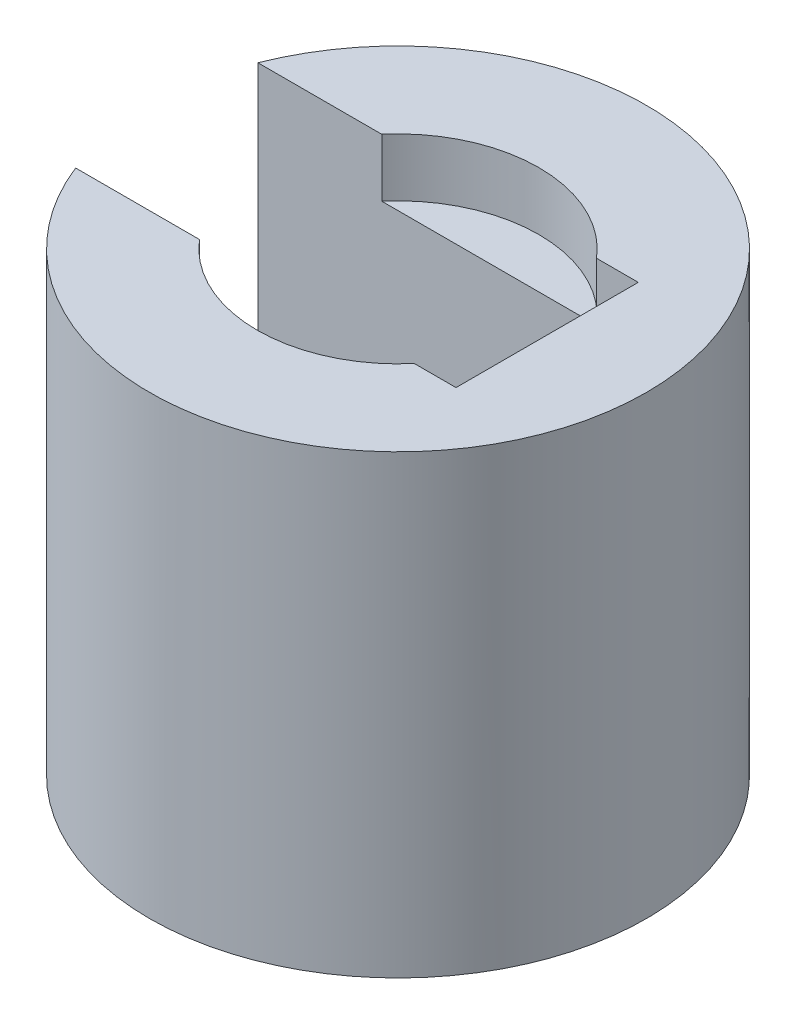
from build123d import *

# Parameters (mm, degrees)
SKETCH1_R                           = 30
BOSS_EXTRUDE1_DEPTH                 = 55
SKETCH3_R                           = 17
HUB_POCKET_DEPTH                    = 7
SKETCH2_W                           = 53.984190988
SKETCH2_H                           = 22
SERVO_POCKET_DEPTH                  = 50
SERVO_FRONT_MOUNT_REACH             = 71.462
SERVO_FRONT_MOUNT_DIRECTION_2_REACH = 71.462
WIRE_ACCESS_DEPTH                   = 11


with BuildPart() as part:
    # Sketch1 → Boss-Extrude1 (new body)
    with BuildSketch(Plane(origin=(0, 0, 0), x_dir=(1, 0, 0), z_dir=(0, 1, 0))):
        with Locations(Location((0, 0, 0), (0, 0, 270))):
            Circle(SKETCH1_R)
    extrude(amount=BOSS_EXTRUDE1_DEPTH)

    # Sketch3 → hub pocket (cut)
    with BuildSketch(Plane(origin=(0, 55, 0), x_dir=(1, 0, 0), z_dir=(0, 1, 0))):
        with Locations(Location((0, 0, 0), (0, 0, 270))):
            Circle(SKETCH3_R)
    extrude(amount=-HUB_POCKET_DEPTH, mode=Mode.SUBTRACT)

    # Sketch2 → servo pocket (cut)
    with BuildSketch(Plane(origin=(0, 55, 0), x_dir=(1, 0, 0), z_dir=(0, 1, 0))):
        with Locations((-8.992095494, 0)):
            Rectangle(SKETCH2_W, SKETCH2_H)
    extrude(amount=-SERVO_POCKET_DEPTH, mode=Mode.SUBTRACT)

    # Servo front mount: up to this face of the body (flat: up to its plane)
    servo_front_mount_end = Plane(part.part.faces().sort_by_distance((-5.380622048, 28.154550276, -11))[0])
    # Sketch4 → Servo front mount (add, up to the picked face)
    with BuildSketch(Plane.XY, mode=Mode.PRIVATE) as servo_front_mount_sk1:
        Polygon((18, 32.5), (11, 32.5), (11, 27.5), (18, 15.375644347), align=None)
    servo_front_mount_tool1 = split(extrude(servo_front_mount_sk1.sketch, amount=-SERVO_FRONT_MOUNT_REACH, mode=Mode.PRIVATE), bisect_by=servo_front_mount_end, keep=Keep.BOTH, mode=Mode.PRIVATE)
    add(servo_front_mount_tool1.solids().sort_by(Axis((15.139344, 26.415223, 0), (0, 0, -1)))[0])

    # Servo front mount direction 2: up to this face of the body (flat: up to its plane)
    servo_front_mount_direction_2_end = Plane(part.part.faces().sort_by_distance((-5.380622048, 28.154550276, 11))[0])
    # Sketch4 → Servo front mount direction 2 (add, up to the picked face)
    with BuildSketch(Plane.XY, mode=Mode.PRIVATE) as servo_front_mount_direction_2_sk1:
        Polygon((18, 32.5), (11, 32.5), (11, 27.5), (18, 15.375644347), align=None)
    servo_front_mount_direction_2_tool1 = split(extrude(servo_front_mount_direction_2_sk1.sketch, amount=SERVO_FRONT_MOUNT_DIRECTION_2_REACH, mode=Mode.PRIVATE), bisect_by=servo_front_mount_direction_2_end, keep=Keep.BOTH, mode=Mode.PRIVATE)
    add(servo_front_mount_direction_2_tool1.solids().sort_by(Axis((15.139344, 26.415223, 0), (0, 0, 1)))[0])

    # Sketch5 → Wire access (cut, symmetric)
    with BuildSketch(Plane.XY):
        Polygon((18, 15.375644347), (23.990381057, 5), (18, 5), align=None)
    extrude(amount=WIRE_ACCESS_DEPTH, both=True, mode=Mode.SUBTRACT)


solid = part.part
